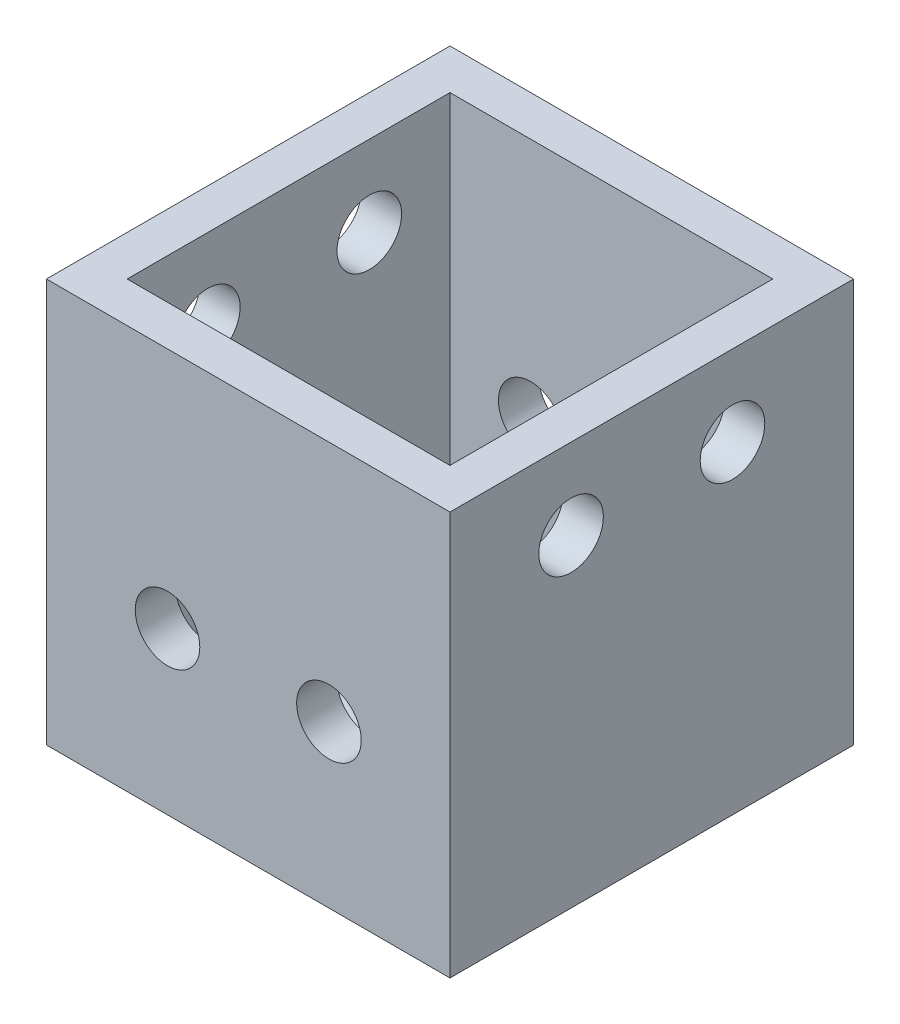
from build123d import *

# Parameters (mm, degrees)
SKETCH1_W               = 50
SKETCH1_H               = 50
BOSS_EXTRUDE1_DEPTH     = 50
SKETCH2_W               = 40
SKETCH2_H               = 40
CUT_EXTRUDE1_DEPTH      = 45
SKETCH3_R               = 4
CUT_EXTRUDE2_DEPTH      = 45
CUT_EXTRUDE3_DEPTH      = 87.602540378
CUT_EXTRUDE3_DEPTH_BACK = 87.602540378
SKETCH4_R               = 4
CUT_EXTRUDE4_DEPTH      = 87.602540378
CUT_EXTRUDE4_DEPTH_BACK = 87.602540378
SKETCH5_R               = 4


with BuildPart() as part:
    # Sketch1 → Boss-Extrude1 (new body)
    with BuildSketch(Plane(origin=(0, 0, 0), x_dir=(1, 0, 0), z_dir=(0, 1, 0))):
        with Locations((25, 25)):
            Rectangle(SKETCH1_W, SKETCH1_H)
    extrude(amount=BOSS_EXTRUDE1_DEPTH)

    # Sketch2 → Cut-Extrude1 (cut)
    with BuildSketch(Plane(origin=(0, 50, 0), x_dir=(1, 0, 0), z_dir=(0, 1, 0))):
        with Locations((25, 25)):
            Rectangle(SKETCH2_W, SKETCH2_H)
    extrude(amount=-CUT_EXTRUDE1_DEPTH, mode=Mode.SUBTRACT)

    # Sketch3 → Cut-Extrude2 (cut)
    with BuildSketch(Plane(origin=(0, 5, 0), x_dir=(1, 0, 0), z_dir=(0, 1, 0))):
        with Locations(Location((13, 37, 0), (0, 0, 270))):
            Circle(SKETCH3_R)
        with Locations(Location((37, 37, 0), (0, 0, 270))):
            Circle(SKETCH3_R)
        with Locations(Location((13, 13, 0), (0, 0, 270))):
            Circle(SKETCH3_R)
        with Locations(Location((37, 13, 0), (0, 0, 270))):
            Circle(SKETCH3_R)
    extrude(amount=-CUT_EXTRUDE2_DEPTH, mode=Mode.SUBTRACT)

    # Sketch4 → Cut-Extrude3 (cut, two sides: drawn at the far end of the back side and taken through both)
    with BuildSketch(Plane.XY.offset(-CUT_EXTRUDE3_DEPTH_BACK)):
        with Locations((15, 20)):
            Circle(SKETCH4_R)
        with Locations((35, 20)):
            Circle(SKETCH4_R)
    extrude(amount=CUT_EXTRUDE3_DEPTH + CUT_EXTRUDE3_DEPTH_BACK, mode=Mode.SUBTRACT)

    # Sketch5 → Cut-Extrude4 (cut, two sides: drawn at the far end of the back side and taken through both)
    with BuildSketch(Plane(origin=(50, 0, 0), x_dir=(0, 0, -1), z_dir=(1, 0, 0)).offset(-CUT_EXTRUDE4_DEPTH_BACK)):
        with Locations((15, 40)):
            Circle(SKETCH5_R)
        with Locations((35, 40)):
            Circle(SKETCH5_R)
    extrude(amount=CUT_EXTRUDE4_DEPTH + CUT_EXTRUDE4_DEPTH_BACK, mode=Mode.SUBTRACT)


solid = part.part
